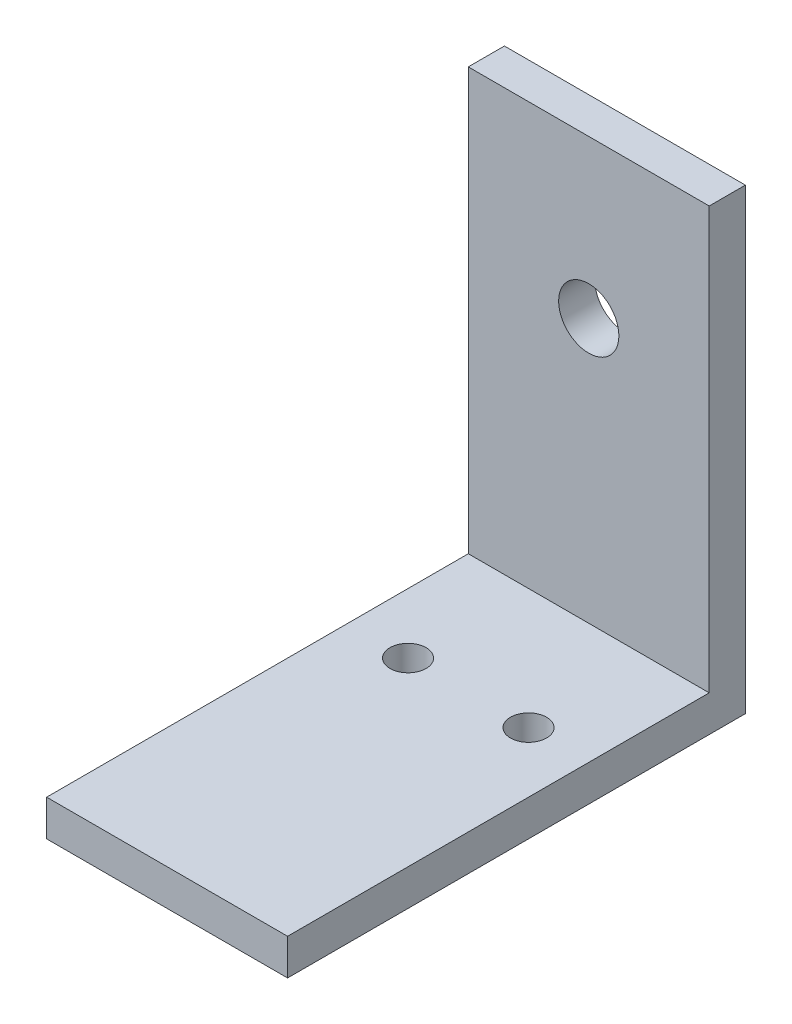
from build123d import *

# Parameters (mm, degrees)
SKETCH_1_W          = 20
SKETCH_1_H          = 38
EXTRUDE_1_DEPTH     = 3
SKETCH_2_W          = 20
SKETCH_2_H          = 3
EXTRUDE_2_DEPTH     = 35
SKETCH_3_R          = 2.5
CUT_EXTRUDE_1_DEPTH = 10
SKETCH_4_R          = 1.5
CUT_EXTRUDE_2_DEPTH = 10


with BuildPart() as part:
    # 草图1 → 凸台-拉伸1 (new body)
    with BuildSketch(Plane.XY):
        Rectangle(SKETCH_1_W, SKETCH_1_H)
    extrude(amount=EXTRUDE_1_DEPTH)

    # 草图2 → 凸台-拉伸2 (add)
    with BuildSketch(Plane.XY.offset(3)):
        with Locations((0, -17.5)):
            Rectangle(SKETCH_2_W, SKETCH_2_H)
    extrude(amount=EXTRUDE_2_DEPTH)

    # 草图3 → 切除-拉伸1 (cut)
    with BuildSketch(Plane(origin=(0, 0, 0), x_dir=(-1, 0, 0), z_dir=(0, 0, -1))):
        with Locations((0, 5.915992135)):
            Circle(SKETCH_3_R)
    extrude(amount=-CUT_EXTRUDE_1_DEPTH, mode=Mode.SUBTRACT)

    # 草图4 → 切除-拉伸2 (cut)
    with BuildSketch(Plane(origin=(0, -16, 0), x_dir=(1, 0, 0), z_dir=(0, 1, 0))):
        with Locations(Location((-5, -13, 0), (0, 0, 270))):
            Circle(SKETCH_4_R)
        with Locations(Location((5, -13, 0), (0, 0, 270))):
            Circle(SKETCH_4_R)
    extrude(amount=-CUT_EXTRUDE_2_DEPTH, mode=Mode.SUBTRACT)


solid = part.part
